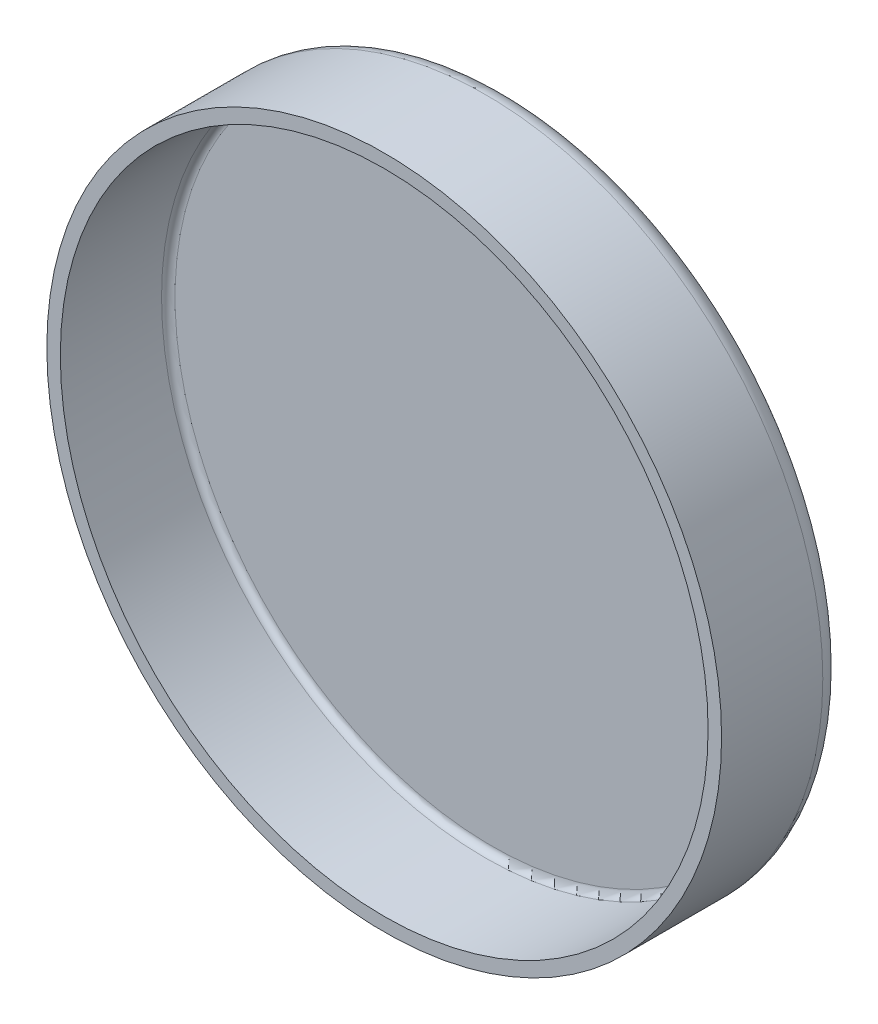
from build123d import *

# Parameters (mm, degrees)
SKETCH1_R           = 25
BOSS_EXTRUDE1_DEPTH = 9
SHELL1_T            = -1
FILLET1_R           = 0.5
FILLET2_R           = 1.5


with BuildPart() as part:
    # Sketch1 → Boss-Extrude1 (new body)
    with BuildSketch(Plane.XY):
        Circle(SKETCH1_R)
    extrude(amount=BOSS_EXTRUDE1_DEPTH)

    # Shell1
    shell1_openings = [part.faces().sort_by_distance(p)[0] for p in [
        (0, 0, 9),
    ]]
    offset(amount=SHELL1_T, openings=shell1_openings, kind=Kind.INTERSECTION)

    # Fillet1
    fillet1_edges = [part.edges().sort_by_distance(p)[0] for p in [
        (-24, 0, 1),
    ]]
    fillet(fillet1_edges, radius=FILLET1_R)

    # Fillet2
    fillet2_edges = [part.edges().sort_by_distance(p)[0] for p in [
        (-25, 0, 0),
    ]]
    fillet(fillet2_edges, radius=FILLET2_R)


solid = part.part
